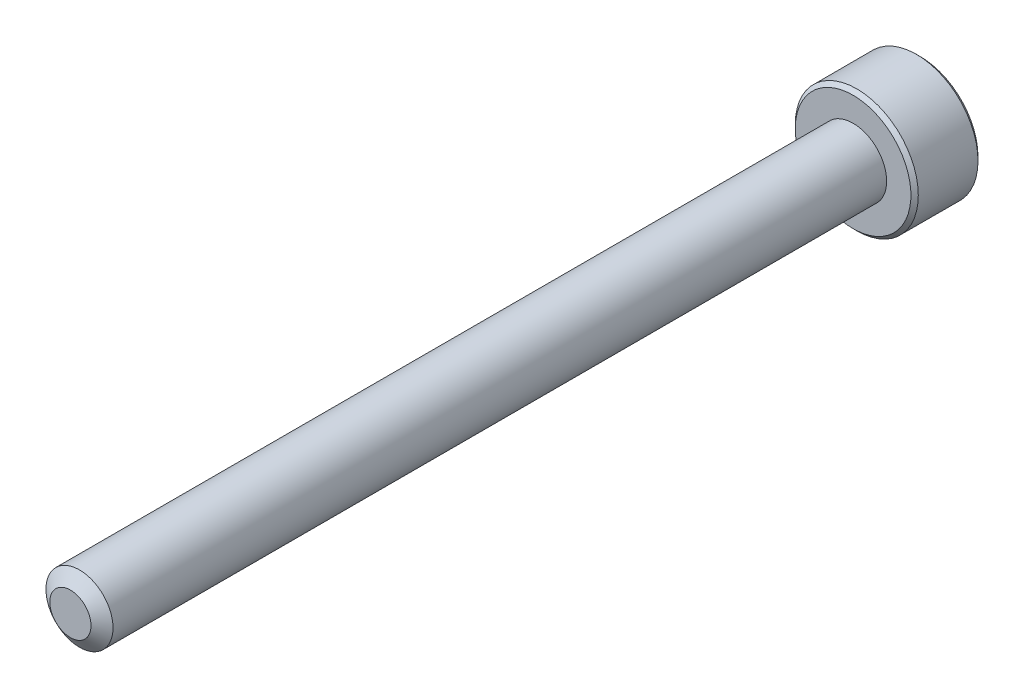
from build123d import *

# Parameters (mm, degrees)
SKETCH1_R          = 1.5
EXTRUDE1_DEPTH     = 35
SKETCH6_R          = 2.75
EXTRUDE2_DEPTH     = 3
CUT_EXTRUDE1_DEPTH = 1.875
CHAMFER1_SIZE      = 0.165


with BuildPart() as part:
    # Sketch1 → Extrude1 (new body)
    with BuildSketch(Plane.XY):
        Circle(SKETCH1_R)
    extrude(amount=-EXTRUDE1_DEPTH)

    # Sketch4 → Cut-Revolve1 (revolve, cut)
    with BuildSketch(Plane(origin=(0, 0, 0), x_dir=(0, 0, -1), z_dir=(1, 0, 0))):
        Polygon((0.405251783, 1.5), (0, 0.921240474), (0, 1.5), align=None)
    revolve(axis=Axis((0, 0, 0), (0, 0, -1)), mode=Mode.SUBTRACT)

    # Sketch6 → Extrude2 (add)
    with BuildSketch(Plane(origin=(0, 0, -35), x_dir=(-1, 0, 0), z_dir=(0, 0, -1))):
        Circle(SKETCH6_R)
    extrude(amount=EXTRUDE2_DEPTH)

    # Sketch7 → Cut-Extrude1 (cut)
    with BuildSketch(Plane(origin=(0, 0, -38), x_dir=(-1, 0, 0), z_dir=(0, 0, -1))):
        Polygon((0, 1.443375673), (-1.25, 0.721687836), (-1.25, -0.721687836), (0, -1.443375673), (1.25, -0.721687836), (1.25, 0.721687836), align=None)
    extrude(amount=-CUT_EXTRUDE1_DEPTH, mode=Mode.SUBTRACT)

    # Cut-Extrude2 cone 1 section (through the dimple's axis) → Cut-Extrude2 (revolve, cut)
    with BuildSketch(Plane(origin=(0, 0, -38), x_dir=(0, 1, 0), z_dir=(1, 0, 0))):
        Polygon((0, 0), (1.443375673, 0), (0, 1.443375673), align=None)
    revolve(axis=Axis((0, 0, -38), (0, 0, 1)), mode=Mode.SUBTRACT)

    # Chamfer1
    chamfer1_edges = [part.edges().sort_by_distance(p)[0] for p in [
        (2.75, 0, -38),
        (2.75, 0, -35),
    ]]
    chamfer(chamfer1_edges, length=CHAMFER1_SIZE)


solid = part.part
